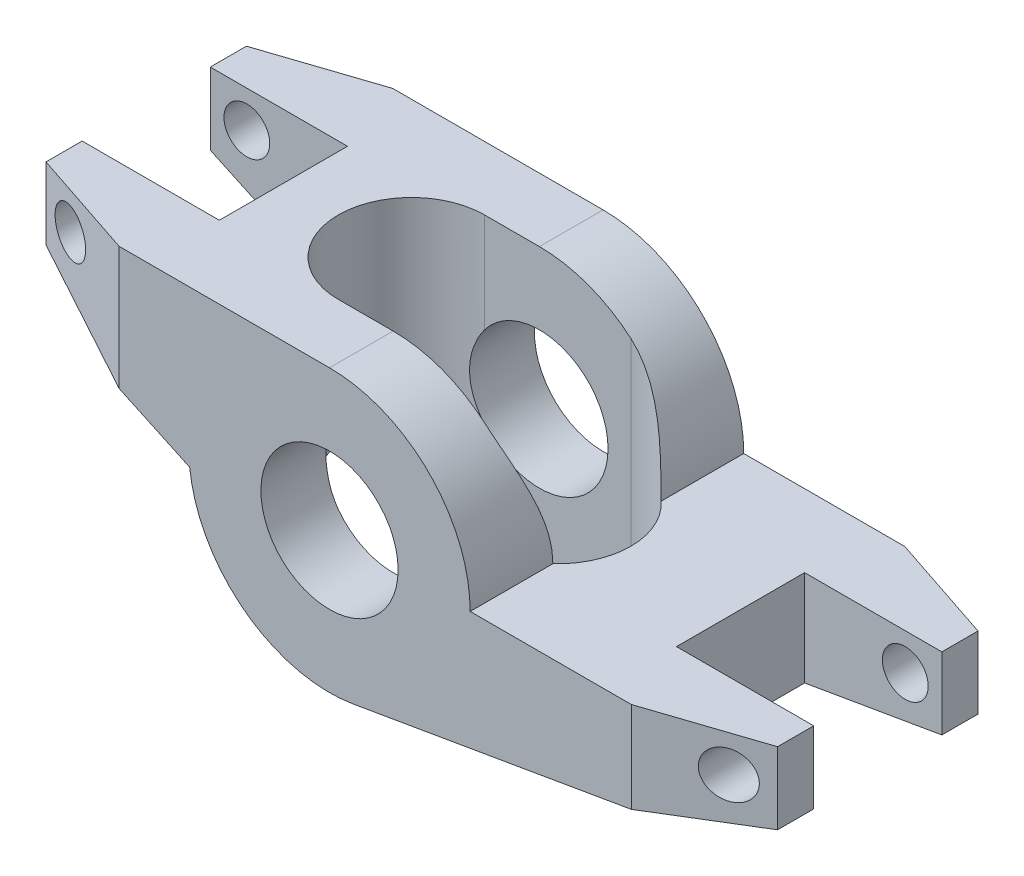
from build123d import *
from OCP.BRepFilletAPI import BRepFilletAPI_MakeChamfer

# Parameters (mm, degrees)
SKETCH1_R               = 4.765
BOSS_EXTRUDE1_DEPTH     = 9.5
CHAMFER1_SIZE           = 7.62
CHAMFER1_SIZE2          = 2.54
CHAMFER2_SIZE           = 2.54
CHAMFER2_SIZE2          = 7.62
CUT_EXTRUDE1_DEPTH      = 32.662585176
CUT_EXTRUDE1_DEPTH_BACK = 32.662585176
SKETCH2_W               = 9.53
SKETCH2_H               = 8.9
CUT_EXTRUDE2_DEPTH      = 32.662585176
CUT_EXTRUDE2_DEPTH_BACK = 32.662585176
CUT_EXTRUDE3_DEPTH      = 32.662585236
CUT_EXTRUDE3_DEPTH_BACK = 32.662585236
SKETCH4_R               = 1.59


with BuildPart() as part:
    # Sketch1 → Boss-Extrude1 (new, symmetric)
    with BuildSketch(Plane.XY):
        with BuildLine():
            Line((0, 9.77), (-22.23, 9.77))
            Line((-22.23, 9.77), (-22.23, 4.77))
            Line((-22.23, 4.77), (-9.711509246, -1.067468107))
            ThreePointArc((-9.711509246, -1.067468107), (-5.877874817, -7.804068659), (1.655323868, -9.628748771))
            Line((1.655323868, -9.628748771), (28.58, -5))
            Line((28.58, -5), (28.58, 0))
            Line((28.58, 0), (9.77, 0))
            ThreePointArc((9.77, 0), (6.908433252, 6.908433252), (0, 9.77))
        make_face()
        Circle(SKETCH1_R, mode=Mode.SUBTRACT)
    extrude(amount=BOSS_EXTRUDE1_DEPTH, both=True)

    # Chamfer1
    chamfer1_edges = [part.edges().sort_by_distance(p)[0] for p in [
        (-22.23, 7.27, -9.5),
        (28.58, -2.5, -9.5),
    ]]
    chamfer1_side = [part.faces().sort_by_distance(p)[0] for p in [
        (-11.115, 9.225622585, -9.5),
    ]]
    chamfer(chamfer1_edges, length=CHAMFER1_SIZE, length2=CHAMFER1_SIZE2, reference=chamfer1_side[0])

    # Chamfer2: one chamfer whose edges measure the first distance from different faces: ONE call of the kernel's chamfer builder (chamfer() names one face for all edges)
    chamfer2_edges_1 = [part.edges().sort_by_distance(p)[0] for p in [
        (-22.23, 7.27, 9.5),
    ]]
    chamfer2_side_1 = [part.faces().sort_by_distance(p)[0] for p in [
        (-22.23, 7.27, 1.27),
    ]]
    chamfer2_edges_2 = [part.edges().sort_by_distance(p)[0] for p in [
        (28.58, -2.5, 9.5),
    ]]
    chamfer2_side_2 = [part.faces().sort_by_distance(p)[0] for p in [
        (28.58, -2.5, 1.27),
    ]]
    chamfer2 = BRepFilletAPI_MakeChamfer(part.part.solid().wrapped)
    for e in chamfer2_edges_1:
        chamfer2.Add(CHAMFER2_SIZE, CHAMFER2_SIZE2, e.wrapped, chamfer2_side_1[0].wrapped)  # the first distance lies on this face
    for e in chamfer2_edges_2:
        chamfer2.Add(CHAMFER2_SIZE, CHAMFER2_SIZE2, e.wrapped, chamfer2_side_2[0].wrapped)  # the first distance lies on this face
    add(Compound.cast(chamfer2.Shape()), mode=Mode.REPLACE)

    # Sketch2 → Cut-Extrude1 (cut, two sides: drawn at the far end of the back side and taken through both)
    with BuildSketch(Plane(origin=(0, 0, 0), x_dir=(1, 0, 0), z_dir=(0, 1, 0)).offset(-CUT_EXTRUDE1_DEPTH_BACK)):
        with Locations((-17.465, 0)):
            Rectangle(SKETCH2_W, SKETCH2_H)
        with Locations((23.815, 0)):
            Rectangle(SKETCH2_W, SKETCH2_H)
    extrude(amount=CUT_EXTRUDE1_DEPTH + CUT_EXTRUDE1_DEPTH_BACK, mode=Mode.SUBTRACT)

    # Sketch3 → Cut-Extrude2 (cut, two sides: drawn at the far end of the back side and taken through both)
    with BuildSketch(Plane(origin=(0, 0, 0), x_dir=(1, 0, 0), z_dir=(0, 1, 0)).offset(-CUT_EXTRUDE2_DEPTH_BACK)):
        with BuildLine():
            Line((-3.81, 5.08), (6.35, 5.08))
            ThreePointArc((6.35, 5.08), (11.43, 0), (6.35, -5.08))
            Line((6.35, -5.08), (-3.81, -5.08))
            ThreePointArc((-3.81, -5.08), (-8.89, 0), (-3.81, 5.08))
        make_face()
    extrude(amount=CUT_EXTRUDE2_DEPTH + CUT_EXTRUDE2_DEPTH_BACK, mode=Mode.SUBTRACT)

    # Sketch4 → Cut-Extrude3 (cut, two sides: drawn at the far end of the back side and taken through both)
    with BuildSketch(Plane.XY.offset(-CUT_EXTRUDE3_DEPTH_BACK)):
        with Locations((-19.69, 7.23)):
            Circle(SKETCH4_R)
        with Locations((26.04, -2.54)):
            Circle(SKETCH4_R)
    extrude(amount=CUT_EXTRUDE3_DEPTH + CUT_EXTRUDE3_DEPTH_BACK, mode=Mode.SUBTRACT)


solid = part.part
